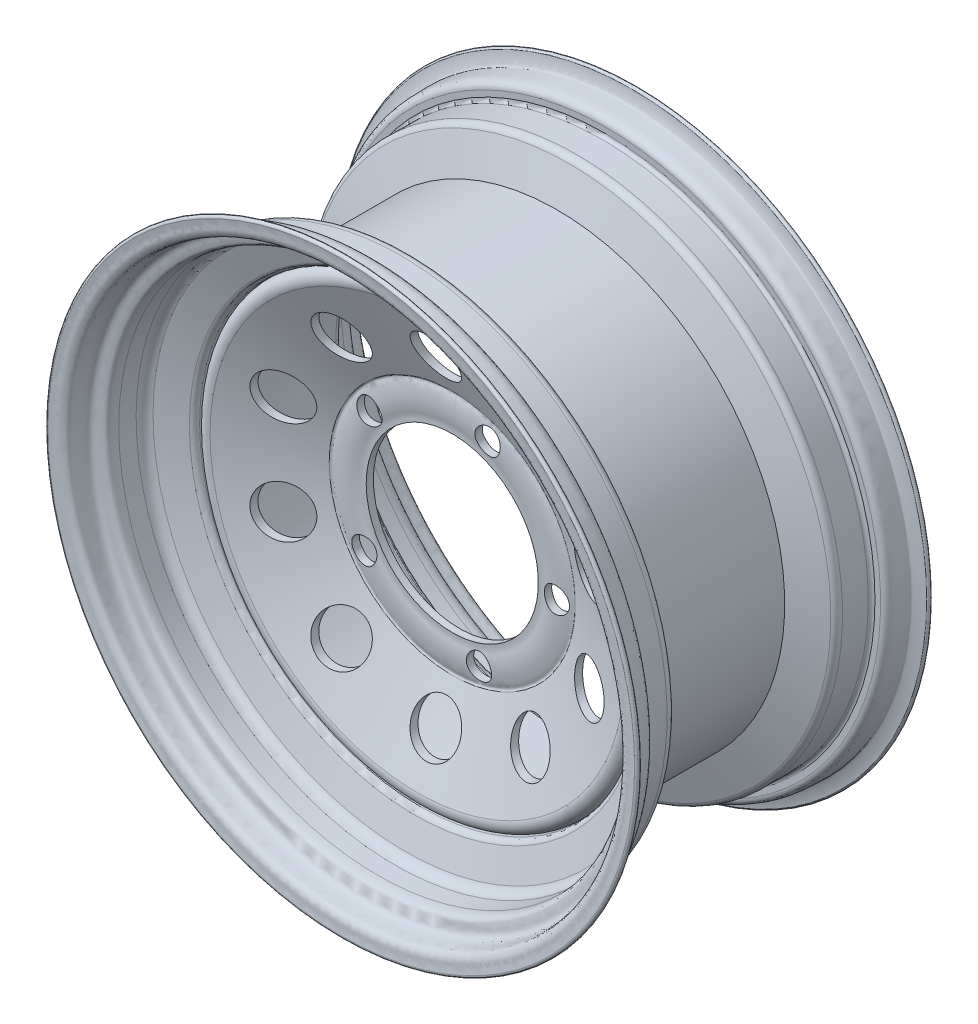
from build123d import *

# Parameters (mm, degrees)
SKETCH3_R          = 16.129951276
CUT_EXTRUDE1_DEPTH = 110
CIRPATTERN1_COUNT  = 10
SKETCH4_R          = 8.5
CUT_EXTRUDE2_DEPTH = 110
CIRPATTERN2_COUNT  = 5


with BuildPart() as part:
    # Sketch1 → Revolve8 (revolve)
    with BuildSketch(Plane(origin=(0, 0, 0), x_dir=(0, 0, -1), z_dir=(1, 0, 0)), mode=Mode.PRIVATE) as revolve8_sk:
        with BuildLine():
            Line((24.960027877, -24.763994532), (36.723600648, -24.763994532))
            ThreePointArc((36.723600648, -24.763994532), (40.85283643, -25.993791168), (43.636371775, -29.282395566))
            Line((43.636371775, -29.282395566), (49.97203657, -47.497431851))
            ThreePointArc((49.97203657, -47.497431851), (51.535544054, -49.581020481), (54.017131295, -50.373246452))
            Line((54.017131295, -50.373246452), (145.982868705, -50.373246452))
            ThreePointArc((145.982868705, -50.373246452), (148.464455946, -49.581020481), (150.02796343, -47.497431851))
            Line((150.02796343, -47.497431851), (156.363628225, -29.282395566))
            ThreePointArc((156.363628225, -29.282395566), (159.14716357, -25.993791168), (163.276399352, -24.763994532))
            Line((163.276399352, -24.763994532), (175.039972123, -24.763994532))
            add(Edge.make_bspline(
                [(199.849758518, -1.732228171), (199.659188656, -3.090354772), (199.176395348, -5.551821464), (199.286442033, -8.285711395), (199.194605066, -9.039479843), (196.973326916, -13.427860856), (193.80947258, -12.974226287), (184.316016368, -13.307323997), (183.277236529, -16.2352178), (182.642188009, -22.039253965), (182.51636618, -24.839327093), (175.039972123, -24.763994532)],
                knots=[0.01192454, 0.01192454, 0.01192454, 0.01192454, 0.036091718, 0.049837867, 0.138325121, 0.163505878, 0.27646468, 0.325384935, 0.603788169, 0.674729716, 1, 1, 1, 1], degree=3))
            ThreePointArc((199.849758518, -1.732228171), (198.644889916, -0.043501251), (196.805541819, -1.002826815))
            add(Edge.make_bspline(
                [(178.952896198, -14.260450038), (178.990064811, -9.875424055), (184.781633752, -9.492584499), (188.172797174, -9.537496775), (193.051920583, -9.401958781), (194.868077155, -9.358610613), (195.341785221, -7.30660731), (196.041691093, -5.056988405), (196.62161294, -2.537065636), (196.805541819, -1.002826815)],
                knots=[0, 0, 0, 0, 0.24349623, 0.297373889, 0.511954075, 0.561962272, 0.747447665, 0.789477452, 0.959074461, 0.959074461, 0.959074461, 0.959074461], degree=3))
            Line((178.952896198, -14.260450038), (178.952896198, -18.07374554))
            ThreePointArc((178.952896198, -18.07374554), (178.289166593, -19.676130553), (176.68678158, -20.339860158))
            Line((176.68678158, -20.339860158), (159.298566891, -20.339860158))
            ThreePointArc((159.298566891, -20.339860158), (156.197349769, -20.734078362), (154.161139824, -23.10616704))
            Line((154.161139824, -23.10616704), (145.982868705, -46.090442382))
            Line((145.982868705, -46.090442382), (139.341638669, -46.090442382))
            Line((139.341638669, -46.090442382), (60.658361331, -46.090442382))
            Line((60.658361331, -46.090442382), (54.017131295, -46.090442382))
            Line((54.017131295, -46.090442382), (45.838860176, -23.10616704))
            ThreePointArc((45.838860176, -23.10616704), (43.802650231, -20.734078362), (40.701433109, -20.339860158))
            Line((40.701433109, -20.339860158), (23.31321842, -20.339860158))
            ThreePointArc((23.31321842, -20.339860158), (21.710833407, -19.676130553), (21.047103802, -18.07374554))
            Line((21.047103802, -18.07374554), (21.047103802, -14.260450038))
            add(Edge.make_bspline(
                [(21.047103802, -14.260450038), (21.009935189, -9.875424055), (15.218366248, -9.492584499), (11.827202826, -9.537496775), (6.948079417, -9.401958781), (5.131922845, -9.358610613), (4.658214779, -7.30660731), (3.958308907, -5.056988405), (3.37838706, -2.537065636), (3.194458181, -1.002826815)],
                knots=[0, 0, 0, 0, 0.24349623, 0.297373889, 0.511954075, 0.561962272, 0.747447665, 0.789477452, 0.959074461, 0.959074461, 0.959074461, 0.959074461], degree=3))
            ThreePointArc((3.194458181, -1.002826815), (1.355110084, -0.043501251), (0.150241482, -1.732228171))
            add(Edge.make_bspline(
                [(0.150241482, -1.732228171), (0.340811344, -3.090354772), (0.823604652, -5.551821464), (0.713557967, -8.285711395), (0.805394934, -9.039479843), (3.026673084, -13.427860856), (6.19052742, -12.974226287), (15.683983632, -13.307323997), (16.722763471, -16.2352178), (17.357811991, -22.039253965), (17.48363382, -24.839327093), (24.960027877, -24.763994532)],
                knots=[0.01192454, 0.01192454, 0.01192454, 0.01192454, 0.036091718, 0.049837867, 0.138325121, 0.163505878, 0.27646468, 0.325384935, 0.603788169, 0.674729716, 1, 1, 1, 1], degree=3))
        make_face()
        with BuildLine():
            Line((57.878477053, -50.564175936), (69.706666261, -50.564175936))
            Line((69.706666261, -50.564175936), (69.706666261, -55.625741505))
            Line((69.706666261, -55.625741505), (60.658361331, -55.625741505))
            Line((60.658361331, -55.625741505), (57.878477053, -55.625741505))
            ThreePointArc((57.878477053, -55.625741505), (56.358186136, -56.392352318), (56.07069305, -58.07054311))
            Line((56.07069305, -58.07054311), (79.515639882, -114.178479104))
            add(Edge.make_bspline(
                [(79.515639882, -114.178479104), (79.650884146, -114.361419935), (79.900709855, -114.73195076), (80.360643959, -115.580224449), (80.778549366, -116.795495422), (80.905461622, -118.293190788), (80.737677507, -119.535132928), (80.474264804, -120.428987061), (80.243820217, -121.020671167), (80.094967077, -121.37586697), (80.040178386, -121.521228748), (80.03963199, -121.524590978), (79.97586895, -121.758571073), (79.858986338, -122.337830462), (79.71360725, -123.140133958), (79.580466003, -123.971170456), (79.458637194, -124.832483989), (79.315863001, -125.996124134), (79.179508776, -127.443780962), (79.097693778, -129.059258707), (79.113849064, -130.81852608), (79.3000361, -132.766996467), (79.522625209, -134.210113885), (79.720905638, -135.132523877), (79.89730161, -135.960314427), (79.987413091, -136.445043894), (80.023578061, -136.660063558)],
                knots=[0.010892342, 0.010892342, 0.010892342, 0.010892342, 0.016801348, 0.022710355, 0.034528367, 0.04634638, 0.058164392, 0.069982405, 0.081800418, 0.09361843, 0.105436443, 0.117254456, 0.129072468, 0.152708493, 0.176344519, 0.199980544, 0.223616569, 0.247252594, 0.294524645, 0.341796695, 0.389068746, 0.483612847, 0.578156948, 0.672701048, 0.719973099, 0.75878964, 0.75878964, 0.75878964, 0.75878964], degree=3))
            Line((80.023578061, -136.660063558), (80.023578061, -136.858395855))
            Line((80.023578061, -136.858395855), (80.023578061, -141.799813721))
            Line((80.023578061, -141.799813721), (75.192263118, -141.799813721))
            add(Edge.make_bspline(
                [(75.192263118, -116.800389491), (76.380360639, -118.006824061), (75.44376141, -119.055745939), (74.545594254, -123.21215451), (73.95284109, -128.39017103), (74.566282721, -137.292751951), (75.52471163, -136.859757973), (75.192263118, -141.799813721)],
                knots=[0, 0, 0, 0, 0.108696425, 0.147430295, 0.360682214, 0.448604833, 1, 1, 1, 1], degree=3))
            Line((75.192263118, -116.800389491), (51.45725616, -59.998287923))
            ThreePointArc((51.45725616, -59.998287923), (52.205215645, -53.605056597), (57.878477053, -50.564175936))
        make_face()
    revolve(revolve8_sk.sketch.rotate(Axis((0, -200, -141.77718572), (0, 0, 1)), 90), axis=Axis((0, -200, -141.77718572), (0, 0, 1)))

    # Sketch3 → Cut-Extrude1 (cut)
    with BuildSketch(Plane.XY):
        with Locations(Location((0, -91.213130872, 0), (0, 0, 225.285458616))):
            Circle(SKETCH3_R)
    cut_extrude1 = extrude(amount=-CUT_EXTRUDE1_DEPTH, mode=Mode.SUBTRACT)

    # CirPattern1: Cut-Extrude1 ×10 about axis
    cirpattern1_axis = Axis((0, -200, 0), (0, 0, 1))
    for i in range(1, CIRPATTERN1_COUNT):
        add(cut_extrude1.rotate(cirpattern1_axis, i * 360 / CIRPATTERN1_COUNT), mode=Mode.SUBTRACT)

    # Sketch4 → Cut-Extrude2 (cut)
    with BuildSketch(Plane.XY):
        with Locations((24.753044182, -133.579331444)):
            Circle(SKETCH4_R)
    cut_extrude2 = extrude(amount=-CUT_EXTRUDE2_DEPTH, mode=Mode.SUBTRACT)

    # CirPattern2: Cut-Extrude2 ×5 about axis
    cirpattern2_axis = Axis((0, -200, 0), (0, 0, 1))
    for i in range(1, CIRPATTERN2_COUNT):
        add(cut_extrude2.rotate(cirpattern2_axis, i * 360 / CIRPATTERN2_COUNT), mode=Mode.SUBTRACT)


solid = part.part
